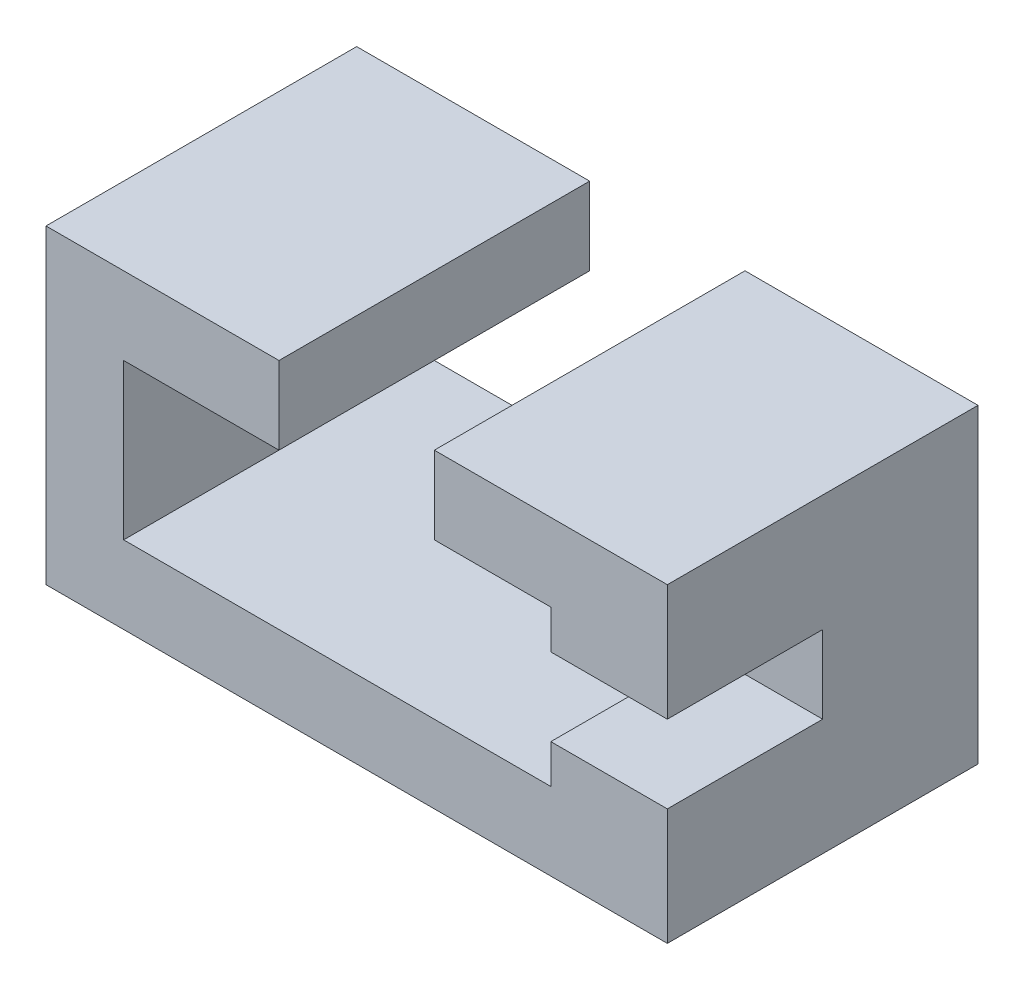
from build123d import *

# Parameters (mm, degrees)
SKETCH1_W           = 80
SKETCH1_H           = 40
BOSS_EXTRUDE1_DEPTH = 40
SKETCH2_W           = 55
SKETCH2_H           = 20
CUT_EXTRUDE1_DEPTH  = 40
SKETCH4_W           = 15
SKETCH4_H           = 10
CUT_EXTRUDE2_DEPTH  = 20
SKETCH5_W           = 20
SKETCH5_H           = 10
CUT_EXTRUDE3_DEPTH  = 61


with BuildPart() as part:
    # Sketch1 → Boss-Extrude1 (new body)
    with BuildSketch(Plane.XY):
        Rectangle(SKETCH1_W, SKETCH1_H)
    extrude(amount=BOSS_EXTRUDE1_DEPTH)

    # Sketch2 → Cut-Extrude1 (cut)
    with BuildSketch(Plane.XY.offset(40)):
        with Locations((-2.5, 0)):
            Rectangle(SKETCH2_W, SKETCH2_H)
    extrude(amount=-CUT_EXTRUDE1_DEPTH, mode=Mode.SUBTRACT)

    # Sketch4 → Cut-Extrude2 (cut)
    with BuildSketch(Plane.XY.offset(40)):
        with Locations((32.5, 0)):
            Rectangle(SKETCH4_W, SKETCH4_H)
    extrude(amount=-CUT_EXTRUDE2_DEPTH, mode=Mode.SUBTRACT)

    # Sketch5 → Cut-Extrude3 (cut, through all)
    with BuildSketch(Plane.XY.offset(40)):
        with Locations((0, 15)):
            Rectangle(SKETCH5_W, SKETCH5_H)
    extrude(amount=-CUT_EXTRUDE3_DEPTH, mode=Mode.SUBTRACT)


solid = part.part
